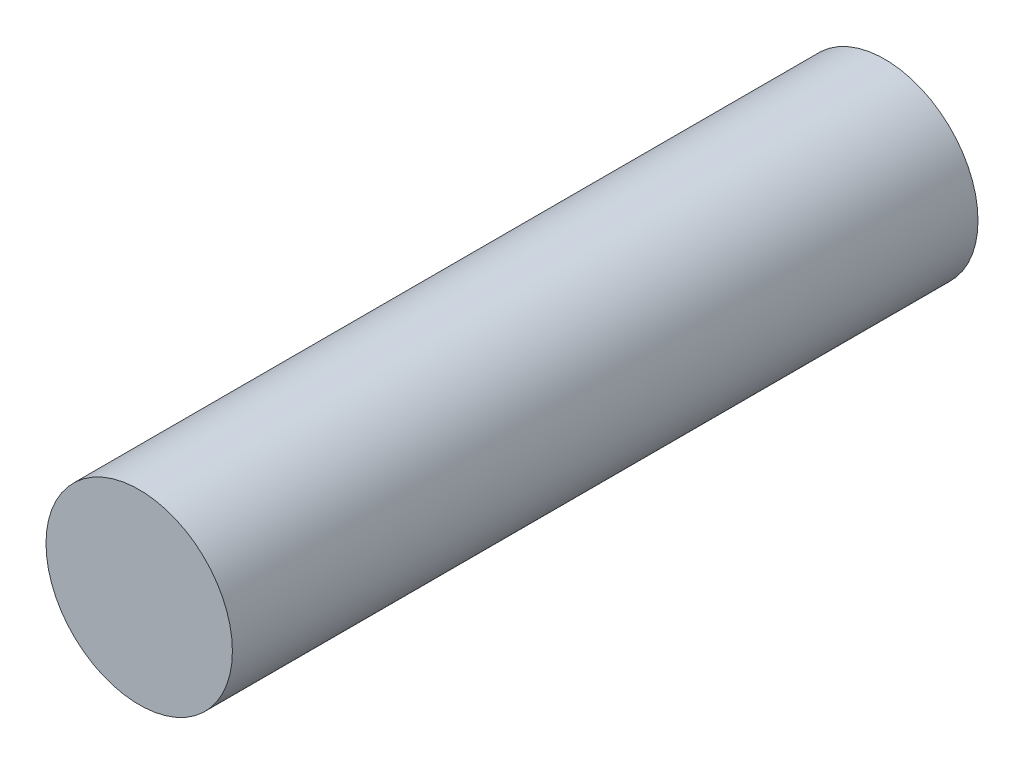
from build123d import *

# Parameters (mm, degrees)
SKETCH1_R           = 5
BOSS_EXTRUDE1_DEPTH = 20


with BuildPart() as part:
    # Sketch1 → Boss-Extrude1 (new, symmetric)
    with BuildSketch(Plane.XY):
        Circle(SKETCH1_R)
    extrude(amount=BOSS_EXTRUDE1_DEPTH, both=True)


solid = part.part
